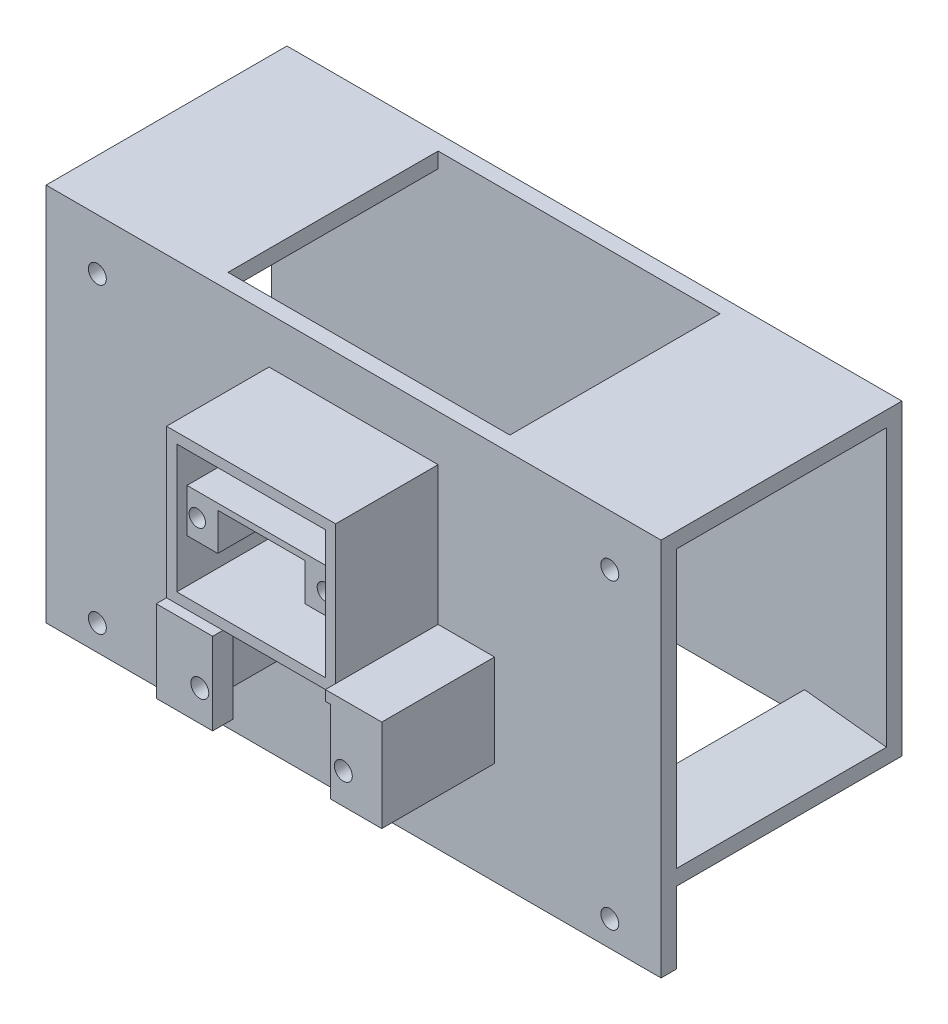
from build123d import *
from build123d.topology import SkipClean

# Parameters (mm, degrees)
SKETCH_1_W           = 120
SKETCH_1_H           = 60
EXTRUDE_1_DEPTH      = 47
SHELL_2_T            = -3
SKETCH_2_W           = 55
SKETCH_2_H           = 41
CUT_EXTRUDE_1_DEPTH  = 3
SKETCH_5_W           = 88
SKETCH_5_H           = 41
CUT_EXTRUDE_3_DEPTH  = 10
SKETCH_6_R           = 2.5
CUT_EXTRUDE_4_DEPTH  = 82.908485519
EXTRUDE_4_REACH      = 82.225
CUT_EXTRUDE_5_REACH  = 83.908
SKETCH_9_W           = 17
SKETCH_9_H           = 25
SKETCH_10_R          = 1.6
EXTRUDE_5_DEPTH      = 18
SKETCH_13_W          = 33
SKETCH_13_H          = 29
SKETCH_13_W_2        = 29
SKETCH_13_H_2        = 25
EXTRUDE_6_DEPTH      = 2
SKETCH_14_W          = 10
SKETCH_14_H          = 16
SKETCH_14_R          = 1.75
EXTRUDE_7_DEPTH      = 22
SKETCH_15_R          = 10.5
CUT_EXTRUDE_7_DEPTH  = 12
CUT_EXTRUDE_8_DEPTH  = 6
SKETCH_19_W          = 34
SKETCH_19_H          = 16
CUT_EXTRUDE_9_DEPTH  = 18
SKETCH_16_W          = 1
SKETCH_16_H          = 16
SKETCH_16_W_2        = 11
SKETCH_16_H_2        = 2
EXTRUDE_8_DEPTH      = 22
SKETCH_20_W          = 6
SKETCH_20_H          = 6
CUT_EXTRUDE_10_DEPTH = 11
SKETCH_21_W          = 120
SKETCH_21_H          = 3
EXTRUDE_9_DEPTH      = 14
SKETCH_11_R          = 1.75
CUT_EXTRUDE_6_DEPTH  = 89.005681635


with BuildPart() as part:
    # 草图1 → 凸台-拉伸1 (new body)
    with BuildSketch(Plane(origin=(0, 0, 0), x_dir=(1, 0, 0), z_dir=(0, 0, -1))):
        Rectangle(SKETCH_1_W, SKETCH_1_H)
    extrude(amount=EXTRUDE_1_DEPTH)

    # 抽壳2
    shell_2_openings = [part.faces().sort_by_distance(p)[0] for p in [
        (60, 0, -23.5),
        (-60, 0, -23.5),
    ]]
    offset(amount=SHELL_2_T, openings=shell_2_openings, kind=Kind.INTERSECTION)

    # 草图2 → 切除-拉伸1 (cut)
    with BuildSketch(Plane(origin=(0, 30, 45), x_dir=(-1, 0, 0), z_dir=(0, -1, 0))):
        with Locations((0, 68.5)):
            Rectangle(SKETCH_2_W, SKETCH_2_H)
    extrude(amount=CUT_EXTRUDE_1_DEPTH, mode=Mode.SUBTRACT)

    # 草图5 → 切除-拉伸3 (cut)
    with BuildSketch(Plane.XZ.offset(30)):
        with Locations((0, -23.5)):
            Rectangle(SKETCH_5_W, SKETCH_5_H)
    extrude(amount=-CUT_EXTRUDE_3_DEPTH, mode=Mode.SUBTRACT)

    # 草图6 → 切除-拉伸4 (cut, through all)
    with BuildSketch(Plane.XY):
        with Locations((0, -18)):
            Circle(SKETCH_6_R)
    extrude(amount=-CUT_EXTRUDE_4_DEPTH, mode=Mode.SUBTRACT)

    # 草图8 → 凸台-拉伸4 (add, up to next)
    with BuildSketch(Plane(origin=(0, 0, -44), x_dir=(-1, 0, 0), z_dir=(0, 0, -1)), mode=Mode.PRIVATE) as extrude_4_sk1:
        Polygon((-60, -27), (-44, -25.270549885), (-44, -30), (-60, -30), align=None)
    extrude_4_tool1 = extrude(extrude_4_sk1.sketch, amount=-EXTRUDE_4_REACH, mode=Mode.PRIVATE) - part.part
    extrude_4 = extrude_4_tool1.solids().sort_by_distance((51.403338, -28.035391, -44))[0]
    add(extrude_4)

    # 镜向1: 凸台-拉伸4 across plane
    add(extrude_4.mirror(Plane(origin=(0, 0, 0), x_dir=(0, 0, 1), z_dir=(1, 0, 0))))

    # 草图9 → 切除-拉伸5 (cut, up to next)
    with BuildSketch(Plane.XY, mode=Mode.PRIVATE) as cut_extrude_5_sk1:
        with Locations((0, 6.5)):
            Rectangle(SKETCH_9_W, SKETCH_9_H)
    cut_extrude_5_tool1 = extrude(cut_extrude_5_sk1.sketch, amount=-CUT_EXTRUDE_5_REACH, mode=Mode.PRIVATE) & part.part
    add(cut_extrude_5_tool1.solids().sort_by_distance((0, 6.5, 0))[0], mode=Mode.SUBTRACT)

    # 草图10 → 凸台-拉伸5 (add)
    with BuildSketch(Plane.XY):
        Polygon((-10.5, -8), (10.5, -8), (16.5, -8), (16.5, 21), (-16.5, 21), (-16.5, -8), align=None)
        with Locations((-12.5, 6.5)):
            Circle(SKETCH_10_R, mode=Mode.SUBTRACT)
        with Locations((12.5, 6.5)):
            Circle(SKETCH_10_R, mode=Mode.SUBTRACT)
        Polygon((-8.5, 11), (14.5, 11), (14.5, 19), (-14.5, 19), (-14.5, 11), align=None, mode=Mode.SUBTRACT)
        Polygon((-8.5, 9.8), (8.5, 9.8), (8.5, 2.5), (14.5, 2.5), (14.5, -6), (-14.5, -6), (-14.5, 2.5), (-8.5, 2.5), align=None, mode=Mode.SUBTRACT)
    extrude(amount=EXTRUDE_5_DEPTH)

    # 草图13 → 凸台-拉伸6 (add)
    with BuildSketch(Plane.XY.offset(18)):
        with Locations((0, 6.5)):
            Rectangle(SKETCH_13_W, SKETCH_13_H)
        with Locations((0, 6.5)):
            Rectangle(SKETCH_13_W_2, SKETCH_13_H_2, mode=Mode.SUBTRACT)
    extrude(amount=EXTRUDE_6_DEPTH)

    # 草图14 → 凸台-拉伸7 (add)
    # profile 1 of 2: a face of its own
    with BuildSketch(Plane.XY):
        with Locations((-10.5, -16)):
            Rectangle(SKETCH_14_W, SKETCH_14_H)
        with Locations((-8, -18)):
            Circle(SKETCH_14_R, mode=Mode.SUBTRACT)
    # profile 2 of 2: a face of its own
    with BuildSketch(Plane.XY):
        with Locations((22.5, -16)):
            Rectangle(SKETCH_14_W, SKETCH_14_H)
        with Locations((20, -18)):
            Circle(SKETCH_14_R, mode=Mode.SUBTRACT)
    extrude(amount=EXTRUDE_7_DEPTH)

    # 草图15 → 切除-拉伸7 (cut)
    with BuildSketch(Plane.XY):
        with Locations((0, -18)):
            Circle(SKETCH_15_R)
    extrude(amount=CUT_EXTRUDE_7_DEPTH, mode=Mode.SUBTRACT)

    # 草图17 → 切除-拉伸8 (cut)
    with SkipClean():  # the faces are left unmerged after this step: merging them gives an invalid solid
        with BuildSketch(Plane(origin=(0, 0, 12), x_dir=(-1, 0, 0), z_dir=(0, 0, -1))):
            with BuildLine():
                Line((5.5, -9.05572809), (5.5, -24))
                Line((5.5, -24), (8.61684397, -24))
                ThreePointArc((8.61684397, -24), (10.278819808, -15.856203519), (5.5, -9.05572809))
            make_face()
        extrude(amount=-CUT_EXTRUDE_8_DEPTH, mode=Mode.SUBTRACT)

    # 草图19 → 切除-拉伸9 (cut)
    with BuildSketch(Plane.XY):
        with Locations((6, -16)):
            Rectangle(SKETCH_19_W, SKETCH_19_H)
    extrude(amount=CUT_EXTRUDE_9_DEPTH, mode=Mode.SUBTRACT)

    # 草图16 → 凸台-拉伸8 (add)
    with BuildSketch(Plane.XY):
        with Locations((-16, -16)):
            Rectangle(SKETCH_16_W, SKETCH_16_H)
        with Locations((22, -7)):
            Rectangle(SKETCH_16_W_2, SKETCH_16_H_2)
    extrude(amount=EXTRUDE_8_DEPTH)

    # 草图20 → 切除-拉伸10 (cut)
    with BuildSketch(Plane(origin=(0, 0, -3), x_dir=(-1, 0, 0), z_dir=(0, 0, -1))):
        with Locations((-12.5, 6.5)):
            Rectangle(SKETCH_20_W, SKETCH_20_H)
        with Locations((12.5, 6.5)):
            Rectangle(SKETCH_20_W, SKETCH_20_H)
    extrude(amount=-CUT_EXTRUDE_10_DEPTH, mode=Mode.SUBTRACT)

    # 草图21 → 凸台-拉伸9 (add)
    with BuildSketch(Plane.XZ.offset(30)):
        with Locations((0, -1.5)):
            Rectangle(SKETCH_21_W, SKETCH_21_H)
    extrude(amount=EXTRUDE_9_DEPTH)

    # 草图11 → 切除-拉伸6 (cut, through all)
    with BuildSketch(Plane(origin=(0, 0, 0), x_dir=(-1, 0, 0), z_dir=(0, 0, -1))):
        with Locations(Location((-50, 20, 0), (0, 0, 180))):
            Circle(SKETCH_11_R)
        with Locations(Location((50, 20, 0), (0, 0, 180))):
            Circle(SKETCH_11_R)
        with Locations(Location((-50, -39, 0), (0, 0, 180))):
            Circle(SKETCH_11_R)
        with Locations(Location((50, -39, 0), (0, 0, 180))):
            Circle(SKETCH_11_R)
    extrude(amount=CUT_EXTRUDE_6_DEPTH, mode=Mode.SUBTRACT)


solid = part.part
